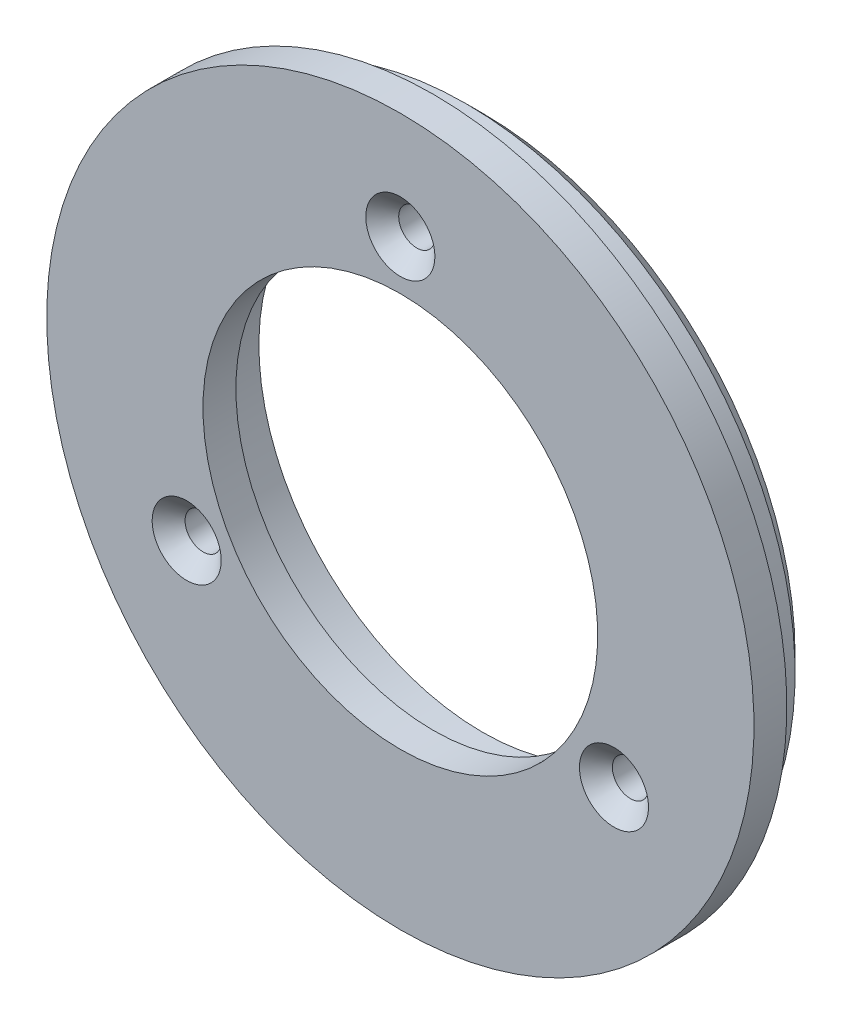
from build123d import *

# Parameters (mm, degrees)
CHAMFER1_SIZE      = 1
SKETCH2_R          = 1.1
CUT_EXTRUDE1_DEPTH = 31.813957876
CHAMFER2_SIZE      = 1


with BuildPart() as part:
    # Sketch1 → Revolve1 (revolve)
    with BuildSketch(Plane(origin=(0, 0, 0), x_dir=(0, 0, -1), z_dir=(1, 0, 0)), mode=Mode.PRIVATE) as revolve1_sk:
        Polygon((0, 21.5), (2, 21.5), (2, 20), (5, 20), (5, 13.6), (2, 13.6), (2, 12), (0, 12), align=None)
    revolve(revolve1_sk.sketch.rotate(Axis((0, 0, 0), (0, 0, -1)), 180), axis=Axis((0, 0, 0), (0, 0, -1)))

    # Chamfer1
    chamfer1_edges = [part.edges().sort_by_distance(p)[0] for p in [
        (0, 20, -5),
    ]]
    chamfer(chamfer1_edges, length=CHAMFER1_SIZE)

    # Sketch2 → Cut-Extrude1 (cut, through all)
    with BuildSketch(Plane(origin=(0, 0, -5), x_dir=(-1, 0, 0), z_dir=(0, 0, -1))):
        with Locations((12.990381057, -7.5)):
            Circle(SKETCH2_R)
        with Locations((-12.990381057, -7.5)):
            Circle(SKETCH2_R)
        with Locations(Location((0, 15, 0), (0, 0, 90))):
            Circle(SKETCH2_R)
    extrude(amount=-CUT_EXTRUDE1_DEPTH, mode=Mode.SUBTRACT)

    # Chamfer2
    chamfer2_edges = [part.edges().sort_by_distance(p)[0] for p in [
        (-11.890381057, -7.5, 0),
        (14.090381057, -7.5, 0),
        (0, 13.9, 0),
    ]]
    chamfer(chamfer2_edges, length=CHAMFER2_SIZE)


solid = part.part
